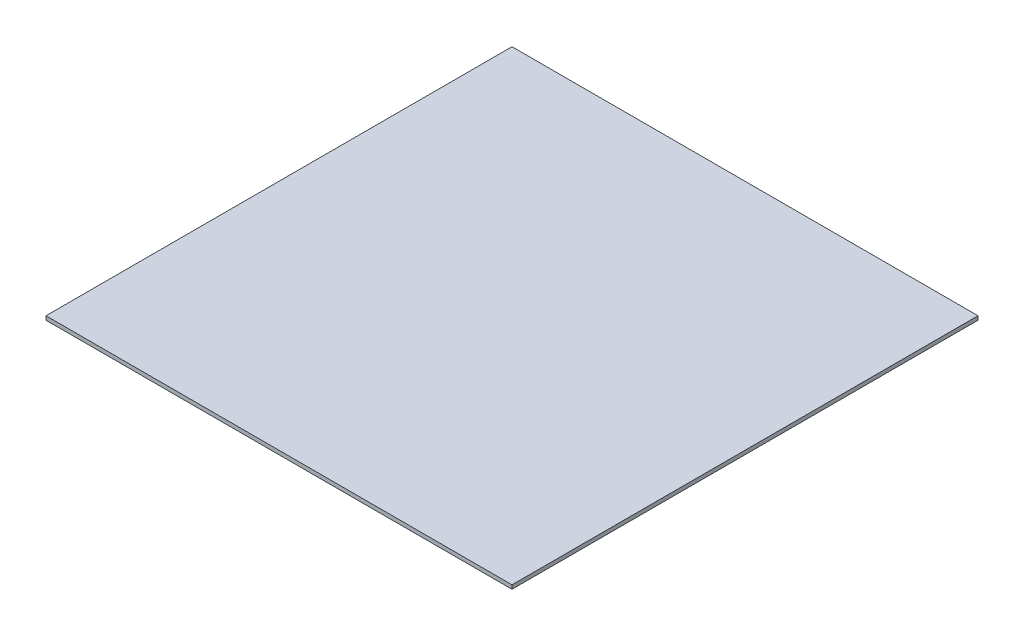
from build123d import *

# Parameters (mm, degrees)
SKETCH1_W           = 381
SKETCH1_H           = 381
BOSS_EXTRUDE1_DEPTH = 3.175


with BuildPart() as part:
    # Sketch1 → Boss-Extrude1 (new body)
    with BuildSketch(Plane(origin=(0, 0, 0), x_dir=(1, 0, 0), z_dir=(0, 1, 0))):
        with Locations((158.260575483, -116.291234559)):
            Rectangle(SKETCH1_W, SKETCH1_H)
    extrude(amount=BOSS_EXTRUDE1_DEPTH)


solid = part.part
